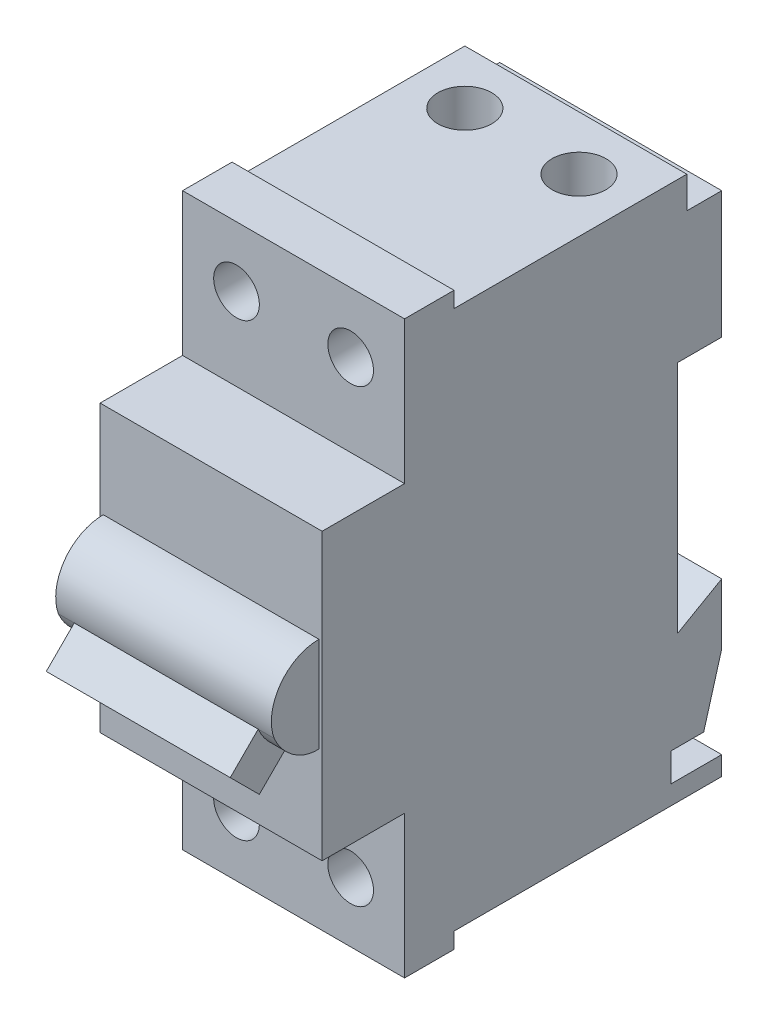
from build123d import *

# Parameters (mm, degrees)
SKETCH_1_W           = 35
SKETCH_1_H           = 45
EXTRUDE_1_DEPTH      = 13
SKETCH_2_W           = 35
SKETCH_2_H           = 90
SKETCH_2_R           = 3.6
EXTRUDE_2_DEPTH      = 7.8
SKETCH_3_W           = 35
SKETCH_3_H           = 85
EXTRUDE_3_DEPTH      = 42.2
CUT_EXTRUDE_1_DEPTH  = 65
EXTRUDE_4_DEPTH      = 17
EXTRUDE_4_DEPTH_BACK = 17
CUT_EXTRUDE_2_DEPTH  = 2.5
CUT_EXTRUDE_START    = -2.5
CUT_EXTRUDE_3_DEPTH  = 2.5
SKETCH_8_R           = 4.25
CUT_EXTRUDE_4_DEPTH  = 10
CUT_EXTRUDE_START_2  = -10
SKETCH_9_R           = 4.25
CUT_EXTRUDE_5_DEPTH  = 10


with BuildPart() as part:
    # Эскиз1 → Вытянуть1 (new body)
    with BuildSketch(Plane.XY):
        Rectangle(SKETCH_1_W, SKETCH_1_H)
    extrude(amount=EXTRUDE_1_DEPTH)

    # Эскиз2 → Вытянуть2 (add)
    with BuildSketch(Plane(origin=(0, 0, 0), x_dir=(-1, 0, 0), z_dir=(0, 0, -1))):
        Rectangle(SKETCH_2_W, SKETCH_2_H)
        with Locations((9, 35.5)):
            Circle(SKETCH_2_R, mode=Mode.SUBTRACT)
        with Locations((-9, 35.5)):
            Circle(SKETCH_2_R, mode=Mode.SUBTRACT)
        with Locations(Location((-9, -35.5, 0), (0, 0, 180))):
            Circle(SKETCH_2_R, mode=Mode.SUBTRACT)
        with Locations(Location((9, -35.5, 0), (0, 0, 180))):
            Circle(SKETCH_2_R, mode=Mode.SUBTRACT)
    extrude(amount=EXTRUDE_2_DEPTH)

    # Эскиз3 → Вытянуть3 (add)
    with BuildSketch(Plane(origin=(0, 0, -7.8), x_dir=(-1, 0, 0), z_dir=(0, 0, -1))):
        Rectangle(SKETCH_3_W, SKETCH_3_H)
    extrude(amount=EXTRUDE_3_DEPTH)

    # Эскиз4 → Вырез-Вытянуть1 (cut)
    with BuildSketch(Plane(origin=(17.5, 0, 0), x_dir=(0, 0, -1), z_dir=(1, 0, 0))):
        Polygon((72.312464651, -50.93467969), (72.312464651, 49.741254374), (44.5, 49.741254374), (44.5, 37.5), (50, 37.5), (50, 17.5), (43, 17.5), (43, -19.5), (50, -15.5), (50, -25.067494223), (47.159605794, -35), (42, -35), (42, -39.5), (50, -39.5), (50, -42.5), align=None)
    extrude(amount=-CUT_EXTRUDE_1_DEPTH, mode=Mode.SUBTRACT)

    # Эскиз5 → Вытянуть4 (add, two sides: drawn at the far end of the back side and taken through both)
    with BuildSketch(Plane(origin=(0, 0, 0), x_dir=(0, 0, -1), z_dir=(1, 0, 0)).offset(-EXTRUDE_4_DEPTH_BACK)):
        with BuildLine():
            Line((-15.487344192, -7.075529582), (-19.89829546, -11.486480851))
            Line((-19.89829546, -11.486480851), (-24.486480851, -6.89829546))
            Line((-24.486480851, -6.89829546), (-20.075529582, -2.487344192))
            ThreePointArc((-20.075529582, -2.487344192), (-7.696699141, 5.303300859), (-15.487344192, -7.075529582))
        make_face()
    extrude(amount=EXTRUDE_4_DEPTH + EXTRUDE_4_DEPTH_BACK)

    # Эскиз6 → Вырез-Вытянуть2 (cut)
    with BuildSketch(Plane(origin=(17, 0, 0), x_dir=(0, 0, -1), z_dir=(1, 0, 0))):
        with BuildLine():
            Line((-20.075529582, -2.487344192), (-24.486480851, -6.89829546))
            Line((-24.486480851, -6.89829546), (-19.89829546, -11.486480851))
            Line((-19.89829546, -11.486480851), (-15.487344192, -7.075529582))
            ThreePointArc((-15.487344192, -7.075529582), (-18.217507711, -5.217507711), (-20.075529582, -2.487344192))
        make_face()
    extrude(amount=-CUT_EXTRUDE_2_DEPTH, mode=Mode.SUBTRACT)

    # Эскиз7 → Вырез-Вытянуть3 (cut)
    with BuildSketch(Plane.ZY.offset(17).offset(CUT_EXTRUDE_START)):
        with BuildLine():
            Line((20.075529582, -2.487344192), (24.486480851, -6.89829546))
            Line((24.486480851, -6.89829546), (19.89829546, -11.486480851))
            Line((19.89829546, -11.486480851), (15.487344192, -7.075529582))
            ThreePointArc((15.487344192, -7.075529582), (18.217507711, -5.217507711), (20.075529582, -2.487344192))
        make_face()
    extrude(amount=CUT_EXTRUDE_3_DEPTH, mode=Mode.SUBTRACT)

    # Эскиз8 → Вырез-Вытянуть4 (cut)
    with BuildSketch(Plane.XZ.offset(42.5)):
        with Locations(Location((9, -36, 0), (0, 0, 270))):
            Circle(SKETCH_8_R)
        with Locations(Location((-9, -36, 0), (0, 0, 270))):
            Circle(SKETCH_8_R)
    extrude(amount=-CUT_EXTRUDE_4_DEPTH, mode=Mode.SUBTRACT)

    # Эскиз9 → Вырез-Вытянуть5 (cut)
    with BuildSketch(Plane(origin=(0, 42.5, 0), x_dir=(-1, 0, 0), z_dir=(0, 1, 0)).offset(CUT_EXTRUDE_START_2)):
        with Locations(Location((-9, -36, 0), (0, 0, 270))):
            Circle(SKETCH_9_R)
        with Locations(Location((9, -36, 0), (0, 0, 270))):
            Circle(SKETCH_9_R)
    extrude(amount=CUT_EXTRUDE_5_DEPTH, mode=Mode.SUBTRACT)


solid = part.part
